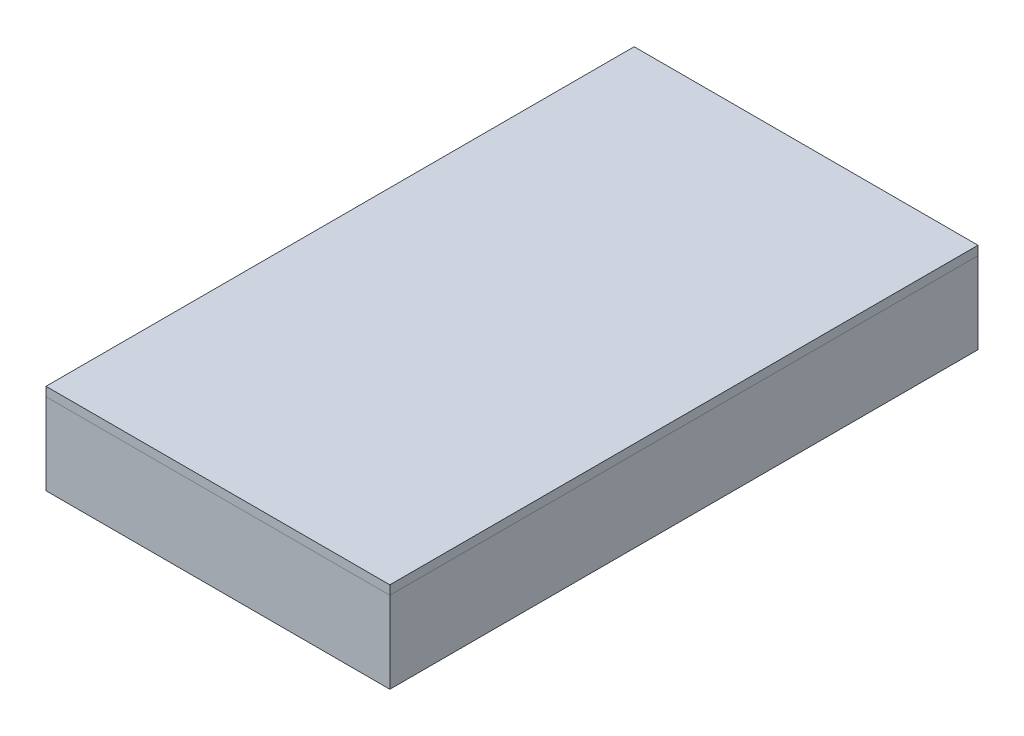
from build123d import *

# Parameters (mm, degrees)
SKETCH3_W           = 38
SKETCH3_H           = 65
BOSS_EXTRUDE1_DEPTH = 0.64
SKETCH3_3_W         = 38
SKETCH3_3_H         = 65
BOSS_EXTRUDE2_DEPTH = 10
SKETCH6_R           = 1.5
BOSS_EXTRUDE3_DEPTH = 3
SKETCH6_3_R         = 1.6
SKETCH6_3_R_2       = 1.5
CUT_EXTRUDE2_DEPTH  = 4
CUT_EXTRUDE1_START  = -10
SKETCH5_R           = 1.45
CUT_EXTRUDE1_DEPTH  = 6
CUT_EXTRUDE3_START  = -5
SKETCH6_4_R         = 1.6
SKETCH6_4_R_2       = 1.5
CUT_EXTRUDE3_DEPTH  = 5


with BuildPart() as part:
    # Sketch3 → Boss-Extrude1 (new body)
    with BuildSketch(Plane(origin=(0, 0, 0), x_dir=(1, 0, 0), z_dir=(0, 1, 0))):
        Rectangle(SKETCH3_W, SKETCH3_H)
    extrude(amount=-BOSS_EXTRUDE1_DEPTH)

    # Sketch3<3> → Boss-Extrude2 (add)
    with BuildSketch(Plane(origin=(0, 0, 0), x_dir=(1, 0, 0), z_dir=(0, 1, 0))):
        Rectangle(SKETCH3_3_W, SKETCH3_3_H)
        with BuildLine():
            Line((-15.806141704, 3.169555117), (-14.563388627, 23.488388316))
            ThreePointArc((-14.563388627, 23.488388316), (-13.982347964, 26.029888674), (-12.614994756, 28.249613324))
            Line((-12.614994756, 28.249613324), (-6.645362379, 21.903707215))
            Line((-6.645362379, 21.903707215), (-7.681935248, 4.955890615))
            Line((-7.681935248, 4.955890615), (-12.929312113, 1.001708527))
            Line((-12.929312113, 1.001708527), (-15.806141704, 3.169555117))
        make_face(mode=Mode.SUBTRACT)
        with BuildLine():
            Line((-11.449601204, 29.345906109), (-5.479968827, 23))
            Line((-5.479968827, 23), (8.001249484, 23))
            Line((8.001249484, 23), (11.371462409, 30.939724094))
            ThreePointArc((11.371462409, 30.939724094), (10.91413207, 30.984914769), (10.454822074, 31))
            Line((10.454822074, 31), (-6.57831024, 31))
            ThreePointArc((-6.57831024, 31), (-9.150541871, 30.57519798), (-11.449601204, 29.345906109))
        make_face(mode=Mode.SUBTRACT)
        Polygon((-11.6, 0), (-6.291820714, 4), (6.291820714, 4), (11.6, 0), (6.291820714, -4), (-6.291820714, -4), align=None, mode=Mode.SUBTRACT)
        with BuildLine():
            Line((9.333267306, 22.043149873), (12.941431756, 30.543452628))
            ThreePointArc((12.941431756, 30.543452628), (16.335726731, 27.796703889), (17.441765663, 23.572660223))
            Line((17.441765663, 23.572660223), (16.212591289, 3.475836847))
            Line((16.212591289, 3.475836847), (12.929312113, 1.001708527))
            Line((12.929312113, 1.001708527), (8.261456028, 4.519190384))
            Line((8.261456028, 4.519190384), (9.333267306, 22.043149873))
        make_face(mode=Mode.SUBTRACT)
        with BuildLine():
            Line((6.62830762, -22.182550065), (7.681935248, -4.955890615))
            Line((7.681935248, -4.955890615), (12.929312113, -1.001708527))
            Line((12.929312113, -1.001708527), (15.806141704, -3.169555117))
            Line((15.806141704, -3.169555117), (14.563388627, -23.488388316))
            ThreePointArc((14.563388627, -23.488388316), (13.062425539, -27.685749543), (9.548273172, -30.428278413))
            Line((9.548273172, -30.428278413), (6.62830762, -22.182550065))
        make_face(mode=Mode.SUBTRACT)
        with BuildLine():
            Line((8.007780574, -30.871252414), (5.220423905, -23))
            Line((5.220423905, -23), (-8.224219459, -23))
            Line((-8.224219459, -23), (-14.971866072, -29.347552106))
            ThreePointArc((-14.971866072, -29.347552106), (-12.859726985, -30.573920624), (-10.454822074, -31))
            Line((-10.454822074, -31), (6.57831024, -31))
            ThreePointArc((6.57831024, -31), (7.295938517, -30.967748092), (8.007780574, -30.871252414))
        make_face(mode=Mode.SUBTRACT)
        with BuildLine():
            Line((-16.068158856, -28.182158554), (-9.320512244, -21.834606448))
            Line((-9.320512244, -21.834606448), (-8.261456028, -4.519190384))
            Line((-8.261456028, -4.519190384), (-12.929312113, -1.001708527))
            Line((-12.929312113, -1.001708527), (-16.212591289, -3.475836847))
            Line((-16.212591289, -3.475836847), (-17.441765663, -23.572660223))
            ThreePointArc((-17.441765663, -23.572660223), (-17.163296944, -25.999091025), (-16.068158856, -28.182158554))
        make_face(mode=Mode.SUBTRACT)
    extrude(amount=-BOSS_EXTRUDE2_DEPTH)


with BuildPart() as body_2:
    # Split1: the piece on the far side of the plane
    add(part.part)
    split(bisect_by=Plane.ZX.offset(-1), keep=Keep.BOTTOM)

    # Sketch6<3> → Cut-Extrude2 (cut)
    # profile 1 of 4: a face of its own
    with BuildSketch(Plane(origin=(0, 0, 0), x_dir=(1, 0, 0), z_dir=(0, 1, 0))):
        with Locations(Location((0, 13.5, 0), (0, 0, 270))):
            Circle(SKETCH6_3_R)
        with Locations(Location((0, 13.5, 0), (0, 0, 270))):
            Circle(SKETCH6_3_R_2, mode=Mode.SUBTRACT)
    # profile 2 of 4: a face of its own
    with BuildSketch(Plane(origin=(0, 0, 0), x_dir=(1, 0, 0), z_dir=(0, 1, 0))):
        with Locations(Location((0, 13.5, 0), (0, 0, 270))):
            Circle(SKETCH6_3_R_2)
    # profile 3 of 4: a face of its own
    with BuildSketch(Plane(origin=(0, 0, 0), x_dir=(1, 0, 0), z_dir=(0, 1, 0))):
        with Locations(Location((0, -13.5, 0), (0, 0, 270))):
            Circle(SKETCH6_3_R)
        with Locations(Location((0, -13.5, 0), (0, 0, 270))):
            Circle(SKETCH6_3_R_2, mode=Mode.SUBTRACT)
    # profile 4 of 4: a face of its own
    with BuildSketch(Plane(origin=(0, 0, 0), x_dir=(1, 0, 0), z_dir=(0, 1, 0))):
        with Locations(Location((0, -13.5, 0), (0, 0, 270))):
            Circle(SKETCH6_3_R_2)
    extrude(amount=-CUT_EXTRUDE2_DEPTH, mode=Mode.SUBTRACT)

    # Sketch5 → Cut-Extrude1 (cut)
    with BuildSketch(Plane(origin=(0, 0, 0), x_dir=(1, 0, 0), z_dir=(0, 1, 0)).offset(CUT_EXTRUDE1_START)):
        with Locations(Location((-16, 29.5, 0), (0, 0, 90))):
            Circle(SKETCH5_R)
        with Locations(Location((16, -29.5, 0), (0, 0, 90))):
            Circle(SKETCH5_R)
    extrude(amount=CUT_EXTRUDE1_DEPTH, mode=Mode.SUBTRACT)

    # Sketch6<4> → Cut-Extrude3 (cut)
    # profile 1 of 6: a face of its own
    with BuildSketch(Plane(origin=(0, 0, 0), x_dir=(1, 0, 0), z_dir=(0, 1, 0)).offset(CUT_EXTRUDE3_START)):
        Polygon((7.478334414, 21.2), (6.536430064, 5.8), (-5.82694367, 5.8), (-4.88503932, 21.2), align=None)
        with Locations(Location((0, 13.5, 0), (0, 0, 270))):
            Circle(SKETCH6_4_R, mode=Mode.SUBTRACT)
    # profile 2 of 6: a face of its own
    with BuildSketch(Plane(origin=(0, 0, 0), x_dir=(1, 0, 0), z_dir=(0, 1, 0)).offset(CUT_EXTRUDE3_START)):
        with Locations(Location((0, 13.5, 0), (0, 0, 270))):
            Circle(SKETCH6_4_R)
        with Locations(Location((0, 13.5, 0), (0, 0, 270))):
            Circle(SKETCH6_4_R_2, mode=Mode.SUBTRACT)
    # profile 3 of 6: a face of its own
    with BuildSketch(Plane(origin=(0, 0, 0), x_dir=(1, 0, 0), z_dir=(0, 1, 0)).offset(CUT_EXTRUDE3_START)):
        with Locations(Location((0, 13.5, 0), (0, 0, 270))):
            Circle(SKETCH6_4_R_2)
    # profile 4 of 6: a face of its own
    with BuildSketch(Plane(origin=(0, 0, 0), x_dir=(1, 0, 0), z_dir=(0, 1, 0)).offset(CUT_EXTRUDE3_START)):
        Polygon((5.82694367, -5.8), (4.88503932, -21.2), (-7.478334414, -21.2), (-6.536430064, -5.8), align=None)
        with Locations(Location((0, -13.5, 0), (0, 0, 270))):
            Circle(SKETCH6_4_R, mode=Mode.SUBTRACT)
    # profile 5 of 6: a face of its own
    with BuildSketch(Plane(origin=(0, 0, 0), x_dir=(1, 0, 0), z_dir=(0, 1, 0)).offset(CUT_EXTRUDE3_START)):
        with Locations(Location((0, -13.5, 0), (0, 0, 270))):
            Circle(SKETCH6_4_R)
        with Locations(Location((0, -13.5, 0), (0, 0, 270))):
            Circle(SKETCH6_4_R_2, mode=Mode.SUBTRACT)
    # profile 6 of 6: a face of its own
    with BuildSketch(Plane(origin=(0, 0, 0), x_dir=(1, 0, 0), z_dir=(0, 1, 0)).offset(CUT_EXTRUDE3_START)):
        with Locations(Location((0, -13.5, 0), (0, 0, 270))):
            Circle(SKETCH6_4_R_2)
    extrude(amount=-CUT_EXTRUDE3_DEPTH, mode=Mode.SUBTRACT)


with BuildPart() as part_1:
    add(part.part)

    # Split1
    split(bisect_by=Plane.ZX.offset(-1), keep=Keep.TOP)

    # Sketch6 → Boss-Extrude3 (add)
    with BuildSketch(Plane(origin=(0, 0, 0), x_dir=(1, 0, 0), z_dir=(0, 1, 0))):
        with Locations(Location((0, 13.5, 0), (0, 0, 270))):
            Circle(SKETCH6_R)
        with Locations(Location((0, -13.5, 0), (0, 0, 270))):
            Circle(SKETCH6_R)
    extrude(amount=-BOSS_EXTRUDE3_DEPTH)


solid = Compound([body_2.part, part_1.part])
